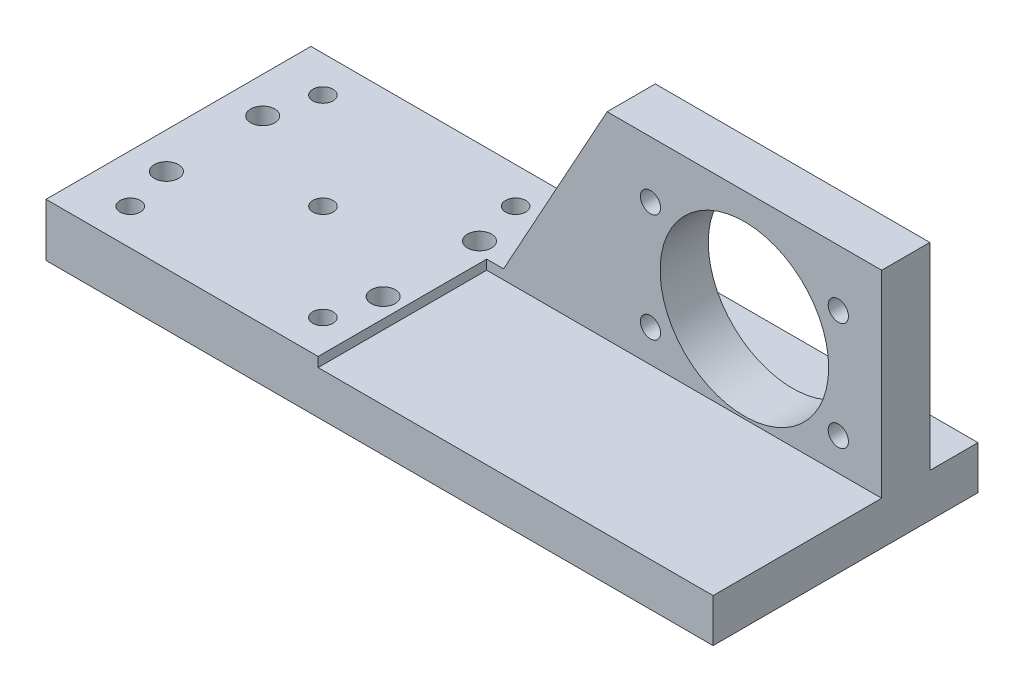
from build123d import *

# Parameters (mm, degrees)
SKETCH_1_W          = 138.5
SKETCH_1_H          = 55
EXTRUDE_1_DEPTH     = 11
EXTRUDE_2_DEPTH     = 10
SKETCH_3_W          = 82
SKETCH_3_H          = 10
CUT_EXTRUDE_1_DEPTH = 2
SKETCH_4_W          = 82
SKETCH_4_H          = 35
CUT_EXTRUDE_2_DEPTH = 2
SKETCH_5_R          = 17.5
CUT_EXTRUDE_3_DEPTH = 152.351412283
HOLE_WIZARD_M5_1_D  = 4.2
SKETCH_9_R          = 4
CUT_EXTRUDE_5_DEPTH = 5
SKETCH_10_R         = 2.5
CUT_EXTRUDE_6_DEPTH = 156.667112776
HOLE_WIZARD_M5_2_D  = 4.2


with BuildPart() as part:
    # 스케치1 → 보스-돌출1 (new body)
    with BuildSketch(Plane(origin=(0, 0, 0), x_dir=(1, 0, 0), z_dir=(0, 1, 0))):
        with Locations((69.25, 27.5)):
            Rectangle(SKETCH_1_W, SKETCH_1_H)
    extrude(amount=EXTRUDE_1_DEPTH)

    # 스케치2 → 보스-돌출2 (add)
    with BuildSketch(Plane(origin=(0, 0, -45), x_dir=(-1, 0, 0), z_dir=(0, 0, -1))):
        Polygon((-138.5, 11), (-138.5, 50), (-81.5, 50), (-60, 11), align=None)
    extrude(amount=-EXTRUDE_2_DEPTH)

    # 스케치3 → 컷-돌출1 (cut)
    with BuildSketch(Plane(origin=(0, 11, 0), x_dir=(1, 0, 0), z_dir=(0, 1, 0))):
        with Locations((97.5, 50)):
            Rectangle(SKETCH_3_W, SKETCH_3_H)
    extrude(amount=-CUT_EXTRUDE_1_DEPTH, mode=Mode.SUBTRACT)

    # 스케치4 → 컷-돌출2 (cut)
    with BuildSketch(Plane(origin=(0, 11, 0), x_dir=(1, 0, 0), z_dir=(0, 1, 0))):
        with Locations((97.5, 17.5)):
            Rectangle(SKETCH_4_W, SKETCH_4_H)
    extrude(amount=-CUT_EXTRUDE_2_DEPTH, mode=Mode.SUBTRACT)

    # 스케치5 → 컷-돌출3 (cut, through all)
    with BuildSketch(Plane.XY.offset(-35)):
        with Locations((110, 27)):
            Circle(SKETCH_5_R)
    extrude(amount=-CUT_EXTRUDE_3_DEPTH, mode=Mode.SUBTRACT)

    # M5 나사 구멍1 (through all)
    with Locations(Plane.XY.offset(-35)):
        with Locations((90.5, 38.25), (129.5, 38.25), (129.5, 15.75), (90.5, 15.75)):
            Hole(HOLE_WIZARD_M5_1_D / 2)

    # 스케치9 → 컷-돌출5 (cut)
    with BuildSketch(Plane(origin=(0, 0, 0), x_dir=(1, 0, 0), z_dir=(0, 1, 0))):
        with Locations(Location((7.5, 37.5, 0), (0, 0, 270))):
            Circle(SKETCH_9_R)
        with Locations(Location((52.5, 37.5, 0), (0, 0, 270))):
            Circle(SKETCH_9_R)
        with Locations(Location((7.5, 17.5, 0), (0, 0, 270))):
            Circle(SKETCH_9_R)
        with Locations(Location((52.5, 17.5, 0), (0, 0, 270))):
            Circle(SKETCH_9_R)
    extrude(amount=CUT_EXTRUDE_5_DEPTH, mode=Mode.SUBTRACT)

    # 스케치10 → 컷-돌출6 (cut, through all)
    with BuildSketch(Plane.XZ.offset(-5)):
        with Locations(Location((52.5, -17.5, 0), (0, 0, 270))):
            Circle(SKETCH_10_R)
        with Locations(Location((52.5, -37.5, 0), (0, 0, 270))):
            Circle(SKETCH_10_R)
        with Locations(Location((7.5, -37.5, 0), (0, 0, 270))):
            Circle(SKETCH_10_R)
        with Locations(Location((7.5, -17.5, 0), (0, 0, 270))):
            Circle(SKETCH_10_R)
    extrude(amount=-CUT_EXTRUDE_6_DEPTH, mode=Mode.SUBTRACT)

    # M5 나사 구멍2 (through all)
    with Locations(Plane(origin=(0, 11, 0), x_dir=(1, 0, 0), z_dir=(0, 1, 0))):
        with Locations((10, 47.5), (50, 47.5), (10, 7.5), (50, 7.5), (30, 27.5)):
            Hole(HOLE_WIZARD_M5_2_D / 2)


solid = part.part
